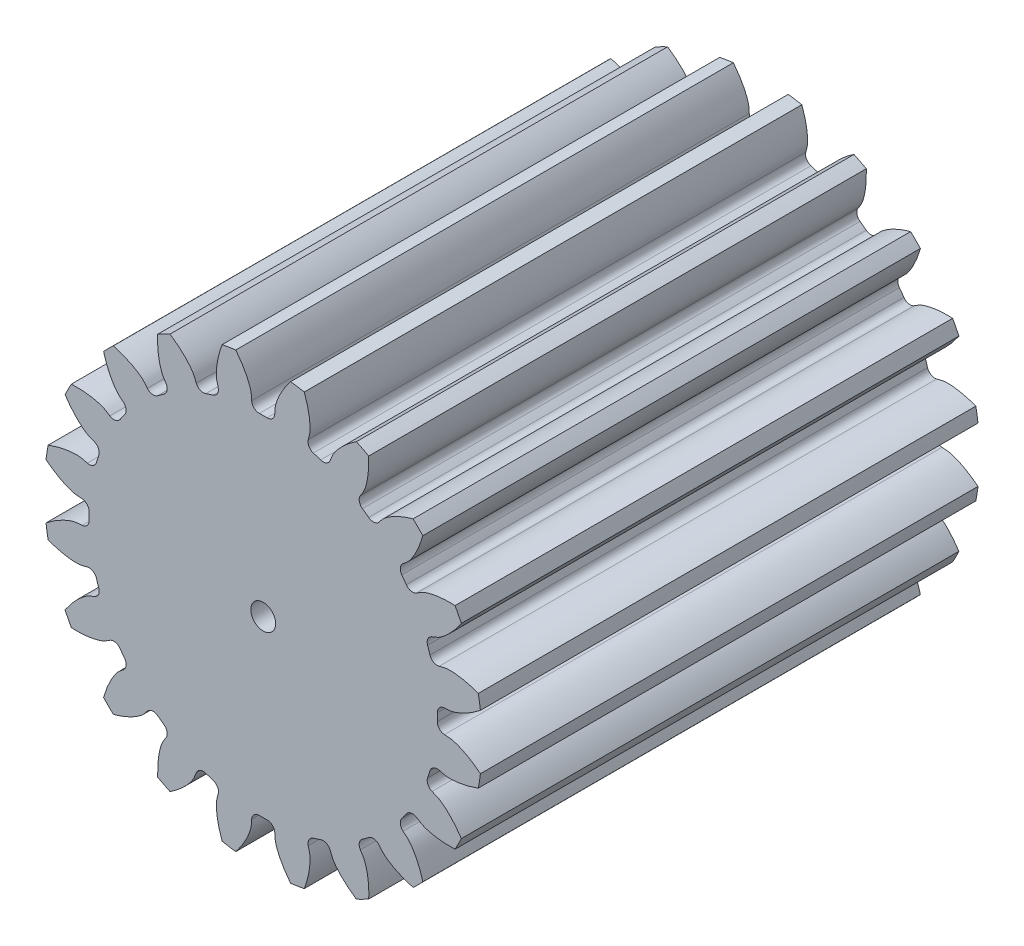
from build123d import *

# Parameters (mm, degrees)
SKETCH_1_R          = 8.8
LASHENA_DEPTH       = 20
CUT_EXTRUDEA_DEPTH  = 20
WWW_KYTOOL_CN_COUNT = 20
SKETCH_3_R          = 0.5
CUT_EXTRUDE_2_DEPTH = 24.504265721


with BuildPart() as part:
    # 草图1 → LaShenA (new body)
    with BuildSketch(Plane.XY):
        Circle(SKETCH_1_R)
    extrude(amount=LASHENA_DEPTH)

    # SketchA → Cut-ExtrudeA (cut)
    with BuildSketch(Plane.XY.offset(20)):
        with BuildLine():
            ThreePointArc((0.154133559, 6.998302855), (0, 7), (-0.154133559, 6.998302855))
            ThreePointArc((-0.154133559, 6.998302855), (-0.366624513, 7.078480337), (-0.46425236, 7.283540421))
            add(Edge.make_bspline(
                [(-0.46425236, 7.283540421), (-0.468772031, 7.356920538), (-0.4704965, 7.453032171), (-0.486423205, 7.558739585), (-0.496297478, 7.603406796), (-0.505007557, 7.638771215), (-0.516199771, 7.679278154), (-0.530115653, 7.724827451), (-0.5470522, 7.775292339), (-0.567282131, 7.830539267), (-0.591079163, 7.890421697), (-0.618709442, 7.954782314), (-0.650433671, 8.023452598), (-0.686505927, 8.096253233), (-0.7271735, 8.172994277), (-0.772676433, 8.253475422), (-0.823247165, 8.337486245), (-0.879110149, 8.424806479), (-0.940481495, 8.515206292), (-1.00756861, 8.608446585), (-1.080569881, 8.704279295), (-1.159674234, 8.802447719), (-1.275945902, 8.938943508), (-1.369280497, 9.039669357), (-1.434517896, 9.106478417)],
                knots=[0.125068197, 0.125068197, 0.125068197, 0.125068197, 0.215847125, 0.244833276, 0.257593391, 0.272673526, 0.290073681, 0.309793857, 0.331834054, 0.356194271, 0.382874509, 0.411874767, 0.443195046, 0.476835345, 0.512795666, 0.551076006, 0.591676368, 0.634596749, 0.679837152, 0.727397575, 0.777278019, 0.829478483, 0.883998968, 1, 1, 1, 1], degree=3))
            ThreePointArc((-1.434517896, 9.106478417), (0, 9.21877382), (1.434517896, 9.106478417))
            add(Edge.make_bspline(
                [(0.46425236, 7.283540421), (0.468772031, 7.356920538), (0.4704965, 7.453032171), (0.486423205, 7.558739585), (0.496297478, 7.603406796), (0.505007557, 7.638771215), (0.516199771, 7.679278154), (0.530115653, 7.724827451), (0.5470522, 7.775292339), (0.567282131, 7.830539267), (0.591079163, 7.890421697), (0.618709442, 7.954782314), (0.650433671, 8.023452598), (0.686505927, 8.096253233), (0.7271735, 8.172994277), (0.772676433, 8.253475422), (0.823247165, 8.337486245), (0.879110149, 8.424806479), (0.940481495, 8.515206292), (1.00756861, 8.608446585), (1.080569881, 8.704279295), (1.159674234, 8.802447719), (1.275945902, 8.938943508), (1.369280497, 9.039669357), (1.434517896, 9.106478417)],
                knots=[0.125068197, 0.125068197, 0.125068197, 0.125068197, 0.215847125, 0.244833276, 0.257593391, 0.272673526, 0.290073681, 0.309793857, 0.331834054, 0.356194271, 0.382874509, 0.411874767, 0.443195046, 0.476835345, 0.512795666, 0.551076006, 0.591676368, 0.634596749, 0.679837152, 0.727397575, 0.777278019, 0.829478483, 0.883998968, 1, 1, 1, 1], degree=3))
            ThreePointArc((0.46425236, 7.283540421), (0.366624513, 7.078480337), (0.154133559, 6.998302855))
        make_face()
    cut_extrudea = extrude(amount=-CUT_EXTRUDEA_DEPTH, mode=Mode.SUBTRACT)

    # www.KYTool.cn: Cut-ExtrudeA ×20 about axis
    www_kytool_cn_axis = Axis((0, 0, -88.99), (0, 0, 1))
    for i in range(1, WWW_KYTOOL_CN_COUNT):
        add(cut_extrudea.rotate(www_kytool_cn_axis, i * 360 / WWW_KYTOOL_CN_COUNT), mode=Mode.SUBTRACT)

    # 草图3 → 切除-拉伸2 (cut, through all)
    with BuildSketch(Plane.XY.offset(20)):
        Circle(SKETCH_3_R)
    extrude(amount=-CUT_EXTRUDE_2_DEPTH, mode=Mode.SUBTRACT)


solid = part.part
